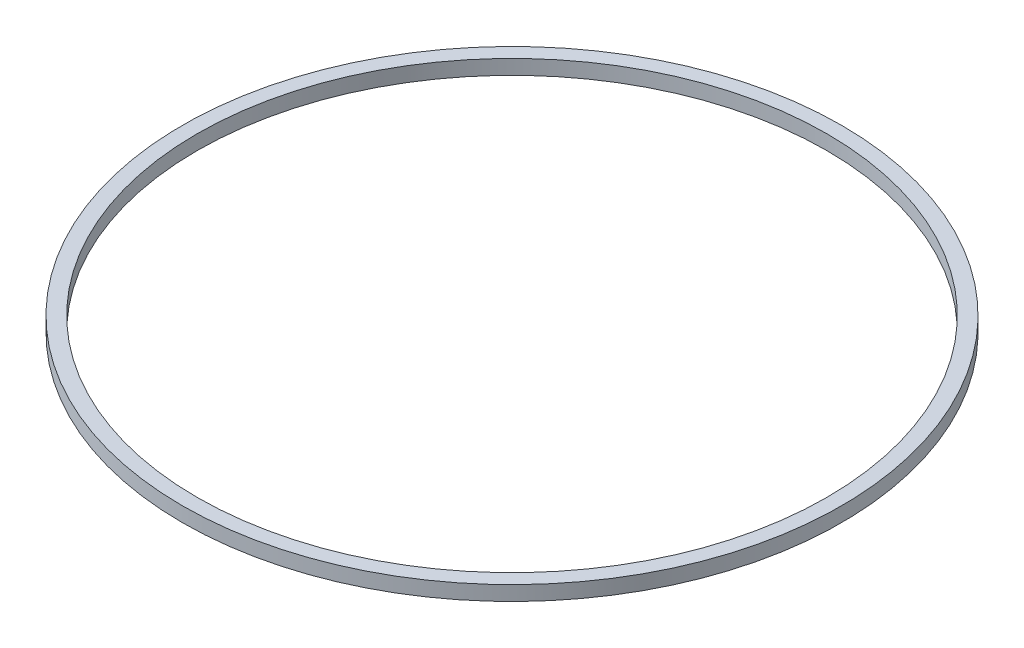
from build123d import *

# Parameters (mm, degrees)
SKETCH1_R           = 225
BOSS_EXTRUDE1_DEPTH = 10
SKETCH2_R           = 215
CUT_EXTRUDE1_DEPTH  = 319.355147595


with BuildPart() as part:
    # Sketch1 → Boss-Extrude1 (new body)
    with BuildSketch(Plane(origin=(0, 0, 0), x_dir=(1, 0, 0), z_dir=(0, 1, 0))):
        with Locations(Location((0, 0, 0), (0, 0, 270))):
            Circle(SKETCH1_R)
    extrude(amount=BOSS_EXTRUDE1_DEPTH)

    # Sketch2 → Cut-Extrude1 (cut, through all)
    with BuildSketch(Plane(origin=(0, 10, 0), x_dir=(1, 0, 0), z_dir=(0, 1, 0))):
        with Locations(Location((0, 0, 0), (0, 0, 270))):
            Circle(SKETCH2_R)
    extrude(amount=-CUT_EXTRUDE1_DEPTH, mode=Mode.SUBTRACT)


solid = part.part
